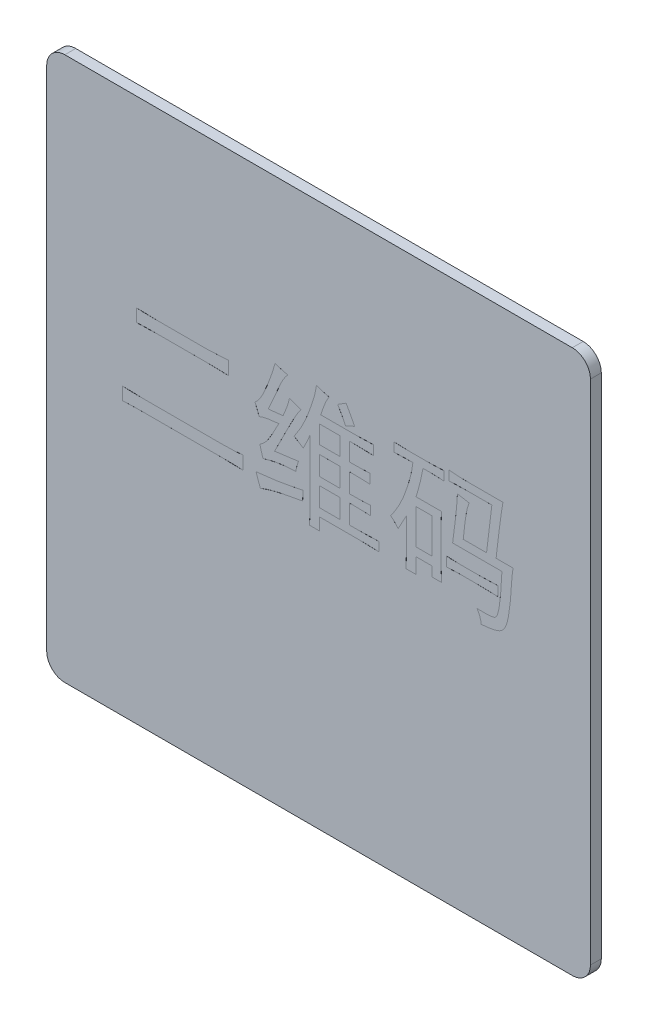
from build123d import *

# Parameters (mm, degrees)
SKETCH_1_W          = 150
SKETCH_1_H          = 150
EXTRUDE_1_DEPTH     = 3
FILLET_1_R          = 5
SKETCH_2_W          = 5.555555555
SKETCH_2_H          = 5.263157895
SKETCH_2_H_2        = 4.970760234
SKETCH_2_W_2        = 4.385964913
SKETCH_2_H_3        = 9.649122807
CUT_EXTRUDE_1_DEPTH = 0.001


with BuildPart() as part:
    # 草图1 → 凸台-拉伸1 (new body)
    with BuildSketch(Plane.XY):
        Rectangle(SKETCH_1_W, SKETCH_1_H)
    extrude(amount=EXTRUDE_1_DEPTH)

    # 圆角1
    fillet_1_edges = [part.edges().sort_by_distance(p)[0] for p in [
        (75, -75, 1.5),
        (-75, -75, 1.5),
        (-75, 75, 1.5),
        (75, 75, 1.5),
    ]]
    fillet(fillet_1_edges, radius=FILLET_1_R)

    # 草图2 → 切除-拉伸1 (cut)
    # profile 1 of 9: a face of its own
    with BuildSketch(Plane.XY.offset(3)):
        with BuildLine():
            add(Edge.make_bspline(
                [(-26.608187135, 3.65497076), (-26.323013282, 3.656655336), (-25.765281416, 3.659949964), (-24.949227561, 3.666790588), (-24.17501589, 3.697113251), (-23.442197097, 3.729213382), (-22.750602914, 3.765136814), (-22.098933489, 3.814417717), (-21.488461424, 3.872008013), (-21.095828364, 3.922845693), (-20.906432749, 3.947368421)],
                knots=[0, 0, 0, 0, 1.198013355, 2.34302766, 3.427946432, 4.4525554, 5.424528626, 6.336949371, 7.197789161, 8, 8, 8, 8], degree=3))
            Line((-20.906432749, 3.947368421), (-20.906432749, 0.292397661))
            add(Edge.make_bspline(
                [(-20.906432749, 0.292397661), (-21.317871677, 0.31594082), (-22.181857979, 0.365379425), (-23.543235953, 0.403957118), (-25.032368749, 0.432096985), (-26.068498144, 0.436370529), (-26.608187135, 0.438596491)],
                knots=[0, 0, 0, 0, 0.866887967, 1.820390043, 2.864705989, 4, 4, 4, 4], degree=3))
            Line((-26.608187135, 0.438596491), (-47.807017544, 0.438596491))
            add(Edge.make_bspline(
                [(-47.807017544, 0.438596491), (-48.413487811, 0.436408949), (-49.570538458, 0.43223546), (-51.223909832, 0.404074428), (-52.7134324, 0.366033277), (-53.651440137, 0.315986879), (-54.093567251, 0.292397661)],
                knots=[0, 0, 0, 0, 1.157187773, 2.207733726, 3.155220703, 4, 4, 4, 4], degree=3))
            Line((-54.093567251, 0.292397661), (-54.093567251, 3.801169591))
            add(Edge.make_bspline(
                [(-54.093567251, 3.801169591), (-53.636995941, 3.777659329), (-52.68630088, 3.728705116), (-51.205860355, 3.690007979), (-49.615662597, 3.661572853), (-48.519977835, 3.657221547), (-47.953216374, 3.65497076)],
                knots=[0, 0, 0, 0, 0.893064927, 1.859583367, 2.892833323, 4, 4, 4, 4], degree=3))
            Line((-47.953216374, 3.65497076), (-26.608187135, 3.65497076))
        make_face()
    # profile 2 of 9: a face of its own
    with BuildSketch(Plane.XY.offset(3)):
        with BuildLine():
            add(Edge.make_bspline(
                [(-30.701754386, 24.269005848), (-30.178348633, 24.29472612), (-29.155032066, 24.345012117), (-27.65654953, 24.411052542), (-26.231042838, 24.490849147), (-25.305049853, 24.538286605), (-24.85380117, 24.561403509)],
                knots=[0, 0, 0, 0, 1.07397973, 2.099750038, 3.073982949, 4, 4, 4, 4], degree=3))
            Line((-24.85380117, 24.561403509), (-24.85380117, 20.906432749))
            add(Edge.make_bspline(
                [(-24.85380117, 20.906432749), (-25.30134963, 20.92983703), (-26.214172279, 20.977572548), (-27.613345457, 21.017317648), (-29.066377156, 21.045655564), (-30.053771588, 21.050280986), (-30.555555556, 21.052631579)],
                knots=[0, 0, 0, 0, 0.942753637, 1.922846234, 2.944411245, 4, 4, 4, 4], degree=3))
            Line((-30.555555556, 21.052631579), (-44.152046784, 21.052631579))
            add(Edge.make_bspline(
                [(-44.152046784, 21.052631579), (-44.718808244, 21.050380792), (-45.814493006, 21.046029486), (-47.404690765, 21.01759436), (-48.885131289, 20.978897223), (-49.83582635, 20.92994301), (-50.292397661, 20.906432749)],
                knots=[0, 0, 0, 0, 1.107166677, 2.140416633, 3.106935073, 4, 4, 4, 4], degree=3))
            Line((-50.292397661, 20.906432749), (-50.292397661, 24.415204678))
            add(Edge.make_bspline(
                [(-50.292397661, 24.415204678), (-49.839436027, 24.391719644), (-48.901368905, 24.343082989), (-47.44801194, 24.304168665), (-45.902936092, 24.275717164), (-44.843348005, 24.271285636), (-44.298245614, 24.269005848)],
                knots=[0, 0, 0, 0, 0.907617697, 1.879643343, 2.909187922, 4, 4, 4, 4], degree=3))
            Line((-44.298245614, 24.269005848), (-30.701754386, 24.269005848))
        make_face()
    # profile 3 of 9: a face of its own
    with BuildSketch(Plane.XY.offset(3)):
        with BuildLine():
            add(Edge.make_bspline(
                [(2.923976608, 29.678362573), (2.80153633, 29.499912457), (2.547382151, 29.129496418), (2.219415274, 28.513585956), (1.896824736, 27.84080946), (1.508161754, 26.877026728), (1.070921309, 25.679980936), (0.742287258, 24.726124382), (0.584795322, 24.269005848)],
                knots=[0, 0, 0, 0, 0.658297212, 1.366453838, 2.12092317, 2.929001811, 4.528279557, 6, 6, 6, 6], degree=3))
            Line((0.584795322, 24.269005848), (9.941520468, 24.269005848))
            add(Edge.make_bspline(
                [(9.941520468, 24.269005848), (10.416232358, 24.271313971), (11.342268482, 24.275816503), (12.694232068, 24.304091529), (13.974343115, 24.34351706), (14.802262682, 24.391757231), (15.204678363, 24.415204678)],
                knots=[0, 0, 0, 0, 1.081761786, 2.110228356, 3.081464224, 4, 4, 4, 4], degree=3))
            Line((15.204678363, 24.415204678), (15.204678363, 21.783625731))
            add(Edge.make_bspline(
                [(15.204678363, 21.783625731), (14.784207065, 21.806990148), (13.932766518, 21.854302322), (12.634666129, 21.894407089), (11.300753347, 21.922760141), (10.398182268, 21.927451126), (9.941520468, 21.929824561)],
                knots=[0, 0, 0, 0, 0.959623765, 1.943206556, 2.95935177, 4, 4, 4, 4], degree=3))
            Line((9.941520468, 21.929824561), (8.479532164, 21.929824561))
            Line((8.479532164, 21.929824561), (8.479532164, 16.959064327))
            add(Edge.make_bspline(
                [(8.479532164, 16.959064327), (9.037271581, 16.961228), (10.096866615, 16.965338552), (11.604044079, 16.993463857), (12.947444883, 17.031185425), (13.787903094, 17.081645092), (14.18128655, 17.105263158)],
                knots=[0, 0, 0, 0, 1.173245013, 2.228934431, 3.171038032, 4, 4, 4, 4], degree=3))
            Line((14.18128655, 17.105263158), (14.18128655, 14.473684211))
            add(Edge.make_bspline(
                [(14.18128655, 14.473684211), (13.787903094, 14.497302277), (12.947444883, 14.547761943), (11.604044079, 14.585483512), (10.096866615, 14.613608817), (9.037271581, 14.617719368), (8.479532164, 14.619883041)],
                knots=[0, 0, 0, 0, 0.828961968, 1.771065569, 2.826754987, 4, 4, 4, 4], degree=3))
            Line((8.479532164, 14.619883041), (8.479532164, 9.356725146))
            add(Edge.make_bspline(
                [(8.479532164, 9.356725146), (8.777351456, 9.355660406), (9.356768492, 9.353588921), (10.201426427, 9.368196215), (11.001059041, 9.376936359), (11.753777315, 9.392422368), (12.462967801, 9.416961812), (13.125734087, 9.433780978), (13.742744807, 9.469613942), (14.137969661, 9.49212812), (14.32748538, 9.502923977)],
                knots=[0, 0, 0, 0, 1.221640602, 2.376741179, 3.465212625, 4.501994121, 5.464954353, 6.376113319, 7.221324142, 8, 8, 8, 8], degree=3))
            Line((14.32748538, 9.502923977), (14.32748538, 7.01754386))
            add(Edge.make_bspline(
                [(14.32748538, 7.01754386), (14.137969661, 7.028339716), (13.742744807, 7.050853894), (13.125734087, 7.086686858), (12.462967801, 7.103506025), (11.753777315, 7.128045468), (11.001059041, 7.143531477), (10.201426427, 7.152271621), (9.356768492, 7.166878915), (8.777351456, 7.16480743), (8.479532164, 7.16374269)],
                knots=[0, 0, 0, 0, 0.778675858, 1.623886681, 2.535045647, 3.498005879, 4.534787375, 5.623258821, 6.778359398, 8, 8, 8, 8], degree=3))
            Line((8.479532164, 7.16374269), (8.479532164, 1.900584795))
            Line((8.479532164, 1.900584795), (10.81871345, 1.900584795))
            add(Edge.make_bspline(
                [(10.81871345, 1.900584795), (11.793518769, 1.907360448), (13.743715819, 1.920915828), (15.692154423, 2.004819283), (16.666666667, 2.046783626)],
                knots=[0, 0, 0, 0, 0.999699306, 2, 2, 2, 2], degree=3))
            Line((16.666666667, 2.046783626), (16.666666667, -0.438596491))
            add(Edge.make_bspline(
                [(16.666666667, -0.438596491), (15.692154423, -0.396632149), (13.743715819, -0.312728694), (11.793518769, -0.299173313), (10.81871345, -0.292397661)],
                knots=[0, 0, 0, 0, 1.000300694, 2, 2, 2, 2], degree=3))
            Line((10.81871345, -0.292397661), (0.292397661, -0.292397661))
            Line((0.292397661, -0.292397661), (0.292397661, -3.65497076))
            Line((0.292397661, -3.65497076), (-2.485380117, -3.65497076))
            add(Edge.make_bspline(
                [(-2.485380117, -3.65497076), (-2.474612779, -3.413110727), (-2.452276123, -2.911376266), (-2.416159307, -2.128267628), (-2.399260917, -1.285084311), (-2.375101923, -0.382728297), (-2.359215512, 0.579339991), (-2.350743215, 1.599166026), (-2.33602101, 2.680277655), (-2.338107522, 3.420325193), (-2.339181287, 3.801169591)],
                knots=[0, 0, 0, 0, 0.779055203, 1.616136557, 2.522486326, 3.492704766, 4.520872923, 5.618651193, 6.774506629, 8, 8, 8, 8], degree=3))
            Line((-2.339181287, 3.801169591), (-2.339181287, 17.98245614))
            add(Edge.make_bspline(
                [(-2.339181287, 17.98245614), (-2.48691284, 17.622384014), (-2.778789265, 16.910981726), (-3.248041443, 15.870743321), (-3.725195706, 14.861647414), (-4.069502783, 14.210759488), (-4.239766082, 13.888888889)],
                knots=[0, 0, 0, 0, 1.034238047, 2.043366479, 3.032425125, 4, 4, 4, 4], degree=3))
            add(Edge.make_bspline(
                [(-4.239766082, 13.888888889), (-4.474049484, 14.050053044), (-4.922801404, 14.358750646), (-5.56899565, 14.791150751), (-6.161388612, 15.169470613), (-6.543936051, 15.391772917), (-6.725146199, 15.497076023)],
                knots=[0, 0, 0, 0, 1.152330951, 2.207201718, 3.150763515, 4, 4, 4, 4], degree=3))
            add(Edge.make_bspline(
                [(-6.725146199, 15.497076023), (-6.301165459, 16.130446669), (-5.461724436, 17.384459537), (-4.631906463, 18.873450631), (-4.118031946, 19.8998508), (-3.850244703, 20.465716201), (-3.584079316, 21.082327406), (-3.299681125, 21.742827324), (-3.01378548, 22.452758433), (-2.722419387, 23.209496182), (-2.423814449, 24.014926907), (-2.120865422, 24.853704119), (-1.825996444, 25.698908749), (-1.56234443, 26.523231279), (-1.321394312, 27.30722167), (-1.116531144, 28.057244581), (-0.935541948, 28.769494832), (-0.791376999, 29.447447748), (-0.667799336, 30.085714003), (-0.611829649, 30.501110628), (-0.584795322, 30.701754386)],
                knots=[0, 0, 0, 0, 2.490442276, 4.930835805, 5.56401899, 6.242237408, 6.976604044, 7.758972555, 8.592638703, 9.477853682, 10.409295137, 11.400190437, 12.392717563, 13.334858334, 14.228778086, 15.073187209, 15.875865532, 16.630288898, 17.338405838, 18, 18, 18, 18], degree=3))
            add(Edge.make_bspline(
                [(-0.584795322, 30.701754386), (-0.311058423, 30.606037478), (0.246179676, 30.411189404), (1.106874956, 30.149534211), (2.000987273, 29.896522444), (2.612939671, 29.751879975), (2.923976608, 29.678362573)],
                knots=[0, 0, 0, 0, 0.951465614, 1.93687037, 2.951373469, 4, 4, 4, 4], degree=3))
        make_face()
        with Locations((3.070175439, 11.988304094)):
            Rectangle(SKETCH_2_W, SKETCH_2_H, mode=Mode.SUBTRACT)
        with Locations((3.070175439, 4.532163742)):
            Rectangle(SKETCH_2_W, SKETCH_2_H, mode=Mode.SUBTRACT)
        with Locations((3.070175439, 19.444444444)):
            Rectangle(SKETCH_2_W, SKETCH_2_H_2, mode=Mode.SUBTRACT)
    # profile 4 of 9: a face of its own
    with BuildSketch(Plane.XY.offset(3)):
        with BuildLine():
            add(Edge.make_bspline(
                [(-8.479532164, 29.239766082), (-8.591868522, 29.122584527), (-8.826221492, 28.878123643), (-9.149447574, 28.453001287), (-9.477439514, 27.973593467), (-9.808048262, 27.435057357), (-10.138969036, 26.839901976), (-10.46058531, 26.180748775), (-10.793104396, 25.467506842), (-11.447465299, 23.904098426), (-12.438559053, 21.530628488), (-13.407133449, 19.45395911), (-13.888888889, 18.421052632)],
                knots=[0, 0, 0, 0, 0.400714873, 0.835960166, 1.317047827, 1.835526487, 2.396351513, 2.998543181, 3.646900272, 4.340084616, 7.184836773, 10, 10, 10, 10], degree=3))
            add(Edge.make_bspline(
                [(-13.888888889, 18.421052632), (-13.207251134, 18.511704658), (-11.846453593, 18.692679162), (-10.478201775, 18.804060076), (-9.795321637, 18.859649123)],
                knots=[0, 0, 0, 0, 1.001820967, 2, 2, 2, 2], degree=3))
            add(Edge.make_bspline(
                [(-9.795321637, 18.859649123), (-9.679243753, 19.12110632), (-9.454209864, 19.627979183), (-9.137053851, 20.367276147), (-8.867878881, 21.069872631), (-8.625988402, 21.728876711), (-8.429791375, 22.350176058), (-8.255319478, 22.925303773), (-8.131378271, 23.463308918), (-8.070239691, 23.810295725), (-8.040935673, 23.976608187)],
                knots=[0, 0, 0, 0, 1.265752913, 2.453846402, 3.558720482, 4.594443122, 5.559199469, 6.441175913, 7.252848044, 8, 8, 8, 8], degree=3))
            Line((-8.040935673, 23.976608187), (-4.824561404, 22.807017544))
            add(Edge.make_bspline(
                [(-4.824561404, 22.807017544), (-4.903590059, 22.712444094), (-5.074825678, 22.507526735), (-5.320585419, 22.149745559), (-5.59506907, 21.733573198), (-5.902534613, 21.258014107), (-6.215539605, 20.708540902), (-6.565435856, 20.103208843), (-6.932540179, 19.431000651), (-7.323927054, 18.687090029), (-7.757443895, 17.861531456), (-8.232165589, 16.933746916), (-8.762450169, 15.904794412), (-9.336826703, 14.767862066), (-9.964944016, 13.52788587), (-10.647866253, 12.183558163), (-11.371024396, 10.729369246), (-11.874209594, 9.72834662), (-12.134502924, 9.210526316)],
                knots=[0, 0, 0, 0, 0.382609317, 0.829020099, 1.346782268, 1.931532289, 2.587270652, 3.310427429, 4.103240491, 4.96591437, 5.921278782, 6.999402525, 8.202873429, 9.516612758, 10.955704963, 12.520150345, 14.199904019, 16, 16, 16, 16], degree=3))
            Line((-12.134502924, 9.210526316), (-5.555555556, 10.087719298))
            add(Edge.make_bspline(
                [(-5.555555556, 10.087719298), (-5.64543568, 9.810217527), (-5.814002537, 9.289773192), (-6.029745977, 8.550962435), (-6.182850989, 7.90149866), (-6.253904057, 7.496171089), (-6.286549708, 7.30994152)],
                knots=[0, 0, 0, 0, 1.21726773, 2.282940721, 3.211089424, 4, 4, 4, 4], degree=3))
            add(Edge.make_bspline(
                [(-6.286549708, 7.30994152), (-6.613362777, 7.305896499), (-7.291161557, 7.297507268), (-8.338518548, 7.221064663), (-9.451260562, 7.108748616), (-10.614023762, 6.945772051), (-11.804746504, 6.743550373), (-12.997453791, 6.495096095), (-14.180195892, 6.196909847), (-14.959999018, 5.964466166), (-15.350877193, 5.847953216)],
                knots=[0, 0, 0, 0, 0.851274813, 1.765513942, 2.734473969, 3.764518578, 4.823550506, 5.88036719, 6.937529005, 8, 8, 8, 8], degree=3))
            add(Edge.make_bspline(
                [(-15.350877193, 5.847953216), (-15.445229652, 6.130621905), (-15.627123908, 6.675555356), (-15.85268507, 7.473626978), (-16.068271564, 8.209804994), (-16.176222885, 8.688310247), (-16.228070175, 8.918128655)],
                knots=[0, 0, 0, 0, 1.119271266, 2.157749964, 3.115196822, 4, 4, 4, 4], degree=3))
            add(Edge.make_bspline(
                [(-16.228070175, 8.918128655), (-16.116384005, 8.971260508), (-15.884731061, 9.081463501), (-15.558273183, 9.308095515), (-15.230006121, 9.577249637), (-14.899682661, 9.891420481), (-14.572124479, 10.256094066), (-14.237441523, 10.662195289), (-13.917747393, 11.12614713), (-13.470439281, 11.806749171), (-12.922162482, 12.726620518), (-12.26953825, 13.887262917), (-11.604438947, 15.10346764), (-11.180834308, 15.945211045), (-10.964912281, 16.374269006)],
                knots=[0, 0, 0, 0, 0.480181851, 0.995965211, 1.539593252, 2.130283722, 2.766143882, 3.444570572, 4.174706954, 4.955210511, 6.611250604, 8.336458694, 10.132600088, 12, 12, 12, 12], degree=3))
            add(Edge.make_bspline(
                [(-10.964912281, 16.374269006), (-11.483332025, 16.32385768), (-12.486264965, 16.226332113), (-13.710173438, 16.055345053), (-14.622999891, 15.889439879), (-15.249894273, 15.745257096), (-15.830941859, 15.567957745), (-16.196474534, 15.421913073), (-16.374269006, 15.350877193)],
                knots=[0, 0, 0, 0, 1.696581853, 3.282201044, 4.023681963, 4.718198358, 5.376533859, 6, 6, 6, 6], degree=3))
            add(Edge.make_bspline(
                [(-16.374269006, 15.350877193), (-16.453510282, 15.55850891), (-16.621188667, 15.997867696), (-16.891323991, 16.694484972), (-17.207170063, 17.459436328), (-17.4283452, 17.995093144), (-17.543859649, 18.274853801)],
                knots=[0, 0, 0, 0, 0.846791778, 1.79185248, 2.846737717, 4, 4, 4, 4], degree=3))
            add(Edge.make_bspline(
                [(-17.543859649, 18.274853801), (-17.431573408, 18.35891512), (-17.190401814, 18.539464419), (-16.850853408, 18.887490862), (-16.506447679, 19.317587608), (-16.156900005, 19.828121032), (-15.798405396, 20.417917134), (-15.430615982, 21.089509416), (-15.060691236, 21.846472267), (-14.552032129, 22.971191887), (-13.931455686, 24.463487985), (-13.234171781, 26.330246892), (-12.575787598, 28.266582115), (-12.185769521, 29.592067239), (-11.988304094, 30.263157895)],
                knots=[0, 0, 0, 0, 0.377511018, 0.810828941, 1.305308524, 1.861135115, 2.476712082, 3.16451831, 3.923617733, 4.746344391, 6.490479131, 8.277299898, 10.115203854, 12, 12, 12, 12], degree=3))
            add(Edge.make_bspline(
                [(-11.988304094, 30.263157895), (-11.714567195, 30.167440987), (-11.157329096, 29.972592913), (-10.296633816, 29.71093772), (-9.402521499, 29.457925953), (-8.790569101, 29.313283484), (-8.479532164, 29.239766082)],
                knots=[0, 0, 0, 0, 0.951465614, 1.93687037, 2.951373469, 4, 4, 4, 4], degree=3))
        make_face()
    # profile 5 of 9: a face of its own
    with BuildSketch(Plane.XY.offset(3)):
        with BuildLine():
            add(Edge.make_bspline(
                [(-4.239766082, 3.801169591), (-4.262861963, 3.563035818), (-4.307609796, 3.101656152), (-4.349426718, 2.424373225), (-4.378021587, 1.785309709), (-4.383379904, 1.369964986), (-4.385964912, 1.169590643)],
                knots=[0, 0, 0, 0, 1.088827181, 2.109582004, 3.088007521, 4, 4, 4, 4], degree=3))
            add(Edge.make_bspline(
                [(-4.385964912, 1.169590643), (-4.83733997, 1.09281565), (-5.764419968, 0.935127361), (-7.190852893, 0.675700148), (-8.687432544, 0.378919107), (-10.237839761, 0.076610003), (-11.78772118, -0.267224465), (-13.288029407, -0.660736411), (-14.715812317, -1.10265425), (-15.632037557, -1.441718653), (-16.081871345, -1.608187135)],
                knots=[0, 0, 0, 0, 0.912559914, 1.874308358, 2.889550752, 3.953461397, 5.022595812, 6.053102821, 7.044143194, 8, 8, 8, 8], degree=3))
            add(Edge.make_bspline(
                [(-16.081871345, -1.608187135), (-16.278556455, -1.060100384), (-16.679412205, 0.056932446), (-17.058419549, 1.181567693), (-17.251461988, 1.754385965)],
                knots=[0, 0, 0, 0, 0.981326127, 2, 2, 2, 2], degree=3))
            add(Edge.make_bspline(
                [(-17.251461988, 1.754385965), (-16.771282743, 1.804264922), (-15.826791919, 1.90237457), (-14.433020211, 2.05857275), (-13.08643937, 2.226343495), (-11.978273745, 2.377276337), (-11.068768659, 2.514479451), (-10.31677739, 2.641427067), (-9.487688887, 2.780421886), (-8.583552292, 2.943846105), (-7.603507558, 3.128206017), (-6.549247071, 3.333178226), (-5.42030033, 3.563488945), (-4.642299777, 3.720126225), (-4.239766082, 3.801169591)],
                knots=[0, 0, 0, 0, 1.318666836, 2.593757936, 3.830843884, 5.025214117, 5.648562045, 6.34317179, 7.108299519, 7.944814852, 8.852780321, 9.832244771, 10.878414007, 12, 12, 12, 12], degree=3))
        make_face()
    # profile 6 of 9: a face of its own
    with BuildSketch(Plane.XY.offset(3)):
        with BuildLine():
            add(Edge.make_bspline(
                [(7.602339181, 30.555555556), (7.656577349, 30.468984532), (7.781313674, 30.269889471), (7.989808398, 29.931479178), (8.214547638, 29.499662682), (8.49804844, 28.99842923), (8.800004998, 28.404513024), (9.15839314, 27.737393808), (9.529748967, 26.976238786), (9.799858734, 26.447101772), (9.941520468, 26.169590643)],
                knots=[0, 0, 0, 0, 0.493093895, 1.134011773, 1.917545387, 2.841519138, 3.91304544, 5.13265968, 6.49619507, 8, 8, 8, 8], degree=3))
            add(Edge.make_bspline(
                [(9.941520468, 26.169590643), (9.742443595, 26.091499789), (9.335729873, 25.931960304), (8.721381965, 25.661439316), (8.094360839, 25.343983919), (7.672221325, 25.116461915), (7.456140351, 25)],
                knots=[0, 0, 0, 0, 0.933353088, 1.906838812, 2.928571492, 4, 4, 4, 4], degree=3))
            add(Edge.make_bspline(
                [(7.456140351, 25), (7.322291221, 25.306609785), (7.040809511, 25.95140327), (6.527826575, 26.934305794), (5.941859513, 27.999050017), (5.495826508, 28.718351103), (5.263157895, 29.093567251)],
                knots=[0, 0, 0, 0, 0.863360023, 1.815626714, 2.860543731, 4, 4, 4, 4], degree=3))
            Line((5.263157895, 29.093567251), (7.602339181, 30.555555556))
        make_face()
    # profile 7 of 9: a face of its own
    with BuildSketch(Plane.XY.offset(3)):
        with BuildLine():
            add(Edge.make_bspline(
                [(30.263157895, 27.777777778), (30.609720846, 27.780295631), (31.317380078, 27.785436926), (32.394994139, 27.814074985), (33.510744404, 27.855323804), (34.264749638, 27.900796007), (34.649122807, 27.923976608)],
                knots=[0, 0, 0, 0, 0.947536656, 1.93480884, 2.947216761, 4, 4, 4, 4], degree=3))
            Line((34.649122807, 27.923976608), (34.649122807, 25.438596491))
            add(Edge.make_bspline(
                [(34.649122807, 25.438596491), (34.262928804, 25.461444974), (33.544887757, 25.503926598), (32.548362628, 25.545729351), (31.716287707, 25.575500097), (31.216175024, 25.581937474), (30.994152047, 25.584795322)],
                knots=[0, 0, 0, 0, 1.268998401, 2.359417629, 3.271670174, 4, 4, 4, 4], degree=3))
            Line((30.994152047, 25.584795322), (28.801169591, 25.584795322))
            add(Edge.make_bspline(
                [(28.801169591, 25.584795322), (28.694502031, 24.984500609), (28.474443912, 23.746076041), (28.031688643, 21.856005709), (27.515536544, 19.869974588), (27.109215706, 18.526224105), (26.900584795, 17.83625731)],
                knots=[0, 0, 0, 0, 0.916233885, 1.890215804, 2.916702871, 4, 4, 4, 4], degree=3))
            Line((26.900584795, 17.83625731), (33.918128655, 17.83625731))
            add(Edge.make_bspline(
                [(33.918128655, 17.83625731), (33.895018949, 17.433828411), (33.850265824, 16.654504296), (33.808943168, 15.52074183), (33.779859028, 14.461196782), (33.774506577, 13.77880586), (33.771929825, 13.450292398)],
                knots=[0, 0, 0, 0, 1.102078905, 2.134232082, 3.101790691, 4, 4, 4, 4], degree=3))
            Line((33.771929825, 13.450292398), (33.771929825, 6.432748538))
            add(Edge.make_bspline(
                [(33.771929825, 6.432748538), (33.771068757, 6.264881978), (33.769253855, 5.911063645), (33.784485198, 5.353428086), (33.79268624, 4.741483541), (33.809424438, 4.075452422), (33.833414436, 3.353608064), (33.850703386, 2.577228413), (33.887816336, 1.745440023), (33.907793805, 1.173217942), (33.918128655, 0.877192982)],
                knots=[0, 0, 0, 0, 0.72485181, 1.527796002, 2.40866786, 3.367627942, 4.404712684, 5.527496796, 6.720911536, 8, 8, 8, 8], degree=3))
            Line((33.918128655, 0.877192982), (31.286549708, 0.877192982))
            Line((31.286549708, 0.877192982), (31.286549708, 3.50877193))
            Line((31.286549708, 3.50877193), (26.900584795, 3.50877193))
            Line((26.900584795, 3.50877193), (26.900584795, -0.730994152))
            Line((26.900584795, -0.730994152), (24.122807018, -0.730994152))
            add(Edge.make_bspline(
                [(24.122807018, -0.730994152), (24.133196427, -0.43316653), (24.153409322, 0.146265643), (24.190161334, 0.990706594), (24.207920718, 1.790531074), (24.231515275, 2.54307506), (24.248447275, 3.25242095), (24.256551582, 3.91490019), (24.271743059, 4.532107229), (24.269892859, 4.927434009), (24.269005848, 5.116959064)],
                knots=[0, 0, 0, 0, 1.222572305, 2.378549447, 3.467433708, 4.504505659, 5.467364503, 6.378255015, 7.222513313, 8, 8, 8, 8], degree=3))
            Line((24.269005848, 5.116959064), (24.269005848, 11.988304094))
            add(Edge.make_bspline(
                [(24.269005848, 11.988304094), (24.092355532, 11.661487651), (23.729808678, 10.990748556), (23.16524897, 9.95710077), (22.55843477, 8.872725849), (22.142783919, 8.129388205), (21.929824561, 7.748538012)],
                knots=[0, 0, 0, 0, 0.920640067, 1.88946823, 2.918665778, 4, 4, 4, 4], degree=3))
            add(Edge.make_bspline(
                [(21.929824561, 7.748538012), (21.781143486, 7.940520242), (21.484589391, 8.323441314), (20.987710968, 8.853208044), (20.457944238, 9.350086467), (20.075023166, 9.646640562), (19.883040936, 9.795321637)],
                knots=[0, 0, 0, 0, 1.002724816, 2, 2.997275184, 4, 4, 4, 4], degree=3))
            add(Edge.make_bspline(
                [(19.883040936, 9.795321637), (20.101153311, 10.09083295), (20.539324617, 10.684492884), (21.138589662, 11.620552778), (21.725499364, 12.579628086), (22.266602339, 13.580274691), (22.784921978, 14.611568516), (23.26488722, 15.6783273), (23.714968273, 16.778054596), (24.126203329, 17.899224182), (24.499908683, 19.01502163), (24.838962859, 20.095154059), (25.148477002, 21.125109813), (25.399538974, 22.111139656), (25.617692872, 23.047846048), (25.797826803, 23.935675136), (25.936693909, 24.775310593), (25.995134404, 25.320960332), (26.023391813, 25.584795322)],
                knots=[0, 0, 0, 0, 1.029735011, 2.068659954, 3.115569091, 4.182453475, 5.257698297, 6.351898127, 7.461998532, 8.589412383, 9.700274166, 10.761656968, 11.764287938, 12.715744595, 13.614525528, 14.461287621, 15.255994943, 16, 16, 16, 16], degree=3))
            add(Edge.make_bspline(
                [(26.023391813, 25.584795322), (25.146036161, 25.578017986), (23.390673337, 25.564458281), (21.63726399, 25.480560801), (20.760233918, 25.438596491)],
                knots=[0, 0, 0, 0, 0.999628839, 2, 2, 2, 2], degree=3))
            Line((20.760233918, 25.438596491), (20.760233918, 27.923976608))
            add(Edge.make_bspline(
                [(20.760233918, 27.923976608), (21.184327366, 27.900915428), (21.999786628, 27.856572717), (23.178640974, 27.814987609), (24.265254256, 27.785838079), (24.960275201, 27.780384042), (25.292397661, 27.777777778)],
                knots=[0, 0, 0, 0, 1.123814671, 2.160903657, 3.12117008, 4, 4, 4, 4], degree=3))
            Line((25.292397661, 27.777777778), (30.263157895, 27.777777778))
        make_face()
        with Locations((29.093567252, 10.67251462)):
            Rectangle(SKETCH_2_W_2, SKETCH_2_H_3, mode=Mode.SUBTRACT)
    # profile 8 of 9: a face of its own
    with BuildSketch(Plane.XY.offset(3)):
        with BuildLine():
            Line((46.34502924, 14.18128655), (47.807017544, 26.315789474))
            Line((47.807017544, 26.315789474), (41.081871345, 26.315789474))
            add(Edge.make_bspline(
                [(41.081871345, 26.315789474), (40.24061974, 26.308690066), (38.533992333, 26.294287663), (36.829304558, 26.211546183), (35.964912281, 26.169590643)],
                knots=[0, 0, 0, 0, 0.985864402, 2, 2, 2, 2], degree=3))
            Line((35.964912281, 26.169590643), (35.964912281, 28.801169591))
            add(Edge.make_bspline(
                [(35.964912281, 28.801169591), (36.399612571, 28.75444771), (37.262453192, 28.661709019), (38.552588093, 28.583504512), (39.823117459, 28.514927285), (40.664836747, 28.510811245), (41.081871345, 28.50877193)],
                knots=[0, 0, 0, 0, 1.022980025, 2.030522499, 3.024211195, 4, 4, 4, 4], degree=3))
            Line((41.081871345, 28.50877193), (50.877192982, 28.50877193))
            add(Edge.make_bspline(
                [(50.877192982, 28.50877193), (50.84644102, 28.335513066), (50.782086251, 27.972933459), (50.682731559, 27.404966725), (50.589466474, 26.78461704), (50.475213713, 26.116737993), (50.379247928, 25.394712363), (50.260990708, 24.627012294), (50.147447295, 23.807496682), (50.038240737, 22.936453063), (49.907139769, 22.017497009), (49.79468166, 21.044900892), (49.659845436, 20.024377408), (49.533315009, 18.951602894), (49.395321368, 17.831274247), (49.261812061, 16.659442138), (49.120815346, 15.437535532), (49.025298552, 14.605448723), (48.976608187, 14.18128655)],
                knots=[0, 0, 0, 0, 0.584319367, 1.222807778, 1.914521407, 2.667309376, 3.472526169, 4.332847181, 5.246562632, 6.21967591, 7.247838915, 8.328732335, 9.470583729, 10.665965448, 11.915617254, 13.218836686, 14.582282208, 16, 16, 16, 16], degree=3))
            Line((48.976608187, 14.18128655), (53.65497076, 14.18128655))
            add(Edge.make_bspline(
                [(53.65497076, 14.18128655), (53.630883248, 14.035183039), (53.579223661, 13.721840296), (53.510033046, 13.21618816), (53.439154423, 12.644223133), (53.374169879, 12.003323526), (53.318500916, 11.293320208), (53.249849683, 10.514170242), (53.191462994, 9.665676952), (53.123982493, 8.455539374), (53.02286473, 6.930324357), (52.842465701, 5.139364306), (52.622359837, 3.419768241), (52.398793731, 2.042924972), (52.194395945, 1.004086449), (52.011047652, 0.303881657), (51.801477264, -0.324035538), (51.568571022, -0.882866838), (51.31063906, -1.372617435), (51.025233672, -1.792309624), (50.712181903, -2.140645201), (50.365760481, -2.429203559), (49.95780954, -2.659443546), (49.482161709, -2.865317641), (48.920452887, -3.04487621), (48.277824526, -3.213831461), (47.547671544, -3.349816447), (46.73494567, -3.473241607), (45.837932751, -3.583923915), (45.209991091, -3.630644678), (44.883040936, -3.65497076)],
                knots=[0, 0, 0, 0, 0.543273685, 1.165138785, 1.872365702, 2.657831568, 3.528410468, 4.485332126, 5.527587493, 6.648719643, 8.932340383, 11.135200124, 13.251966039, 15.292204126, 16.251985859, 17.13544107, 17.945886079, 18.678933978, 19.354412134, 19.973449917, 20.536075629, 21.067721687, 21.619724183, 22.248427602, 22.966729647, 23.781088372, 24.685031015, 25.689990786, 26.797248342, 28, 28, 28, 28], degree=3))
            add(Edge.make_bspline(
                [(44.883040936, -3.65497076), (44.846541359, -3.384694984), (44.772768399, -2.838413477), (44.531579564, -2.026224826), (44.178668121, -1.218873347), (43.870871167, -0.702627355), (43.713450292, -0.438596491)],
                knots=[0, 0, 0, 0, 0.946539849, 1.913146716, 2.932691617, 4, 4, 4, 4], degree=3))
            add(Edge.make_bspline(
                [(43.713450292, -0.438596491), (44.014844836, -0.448507832), (44.590463423, -0.467437015), (45.410073824, -0.480566996), (46.144948516, -0.469285815), (46.791383466, -0.443290416), (47.352021139, -0.403962032), (47.825632918, -0.338632144), (48.214622496, -0.262358232), (48.53790282, -0.161403166), (48.813783826, 0.015158715), (49.038628326, 0.304150516), (49.248545825, 0.688101088), (49.431644739, 1.180570784), (49.603642083, 1.774313275), (49.759090374, 2.47417418), (49.891230822, 3.282688123), (50.124428753, 5.141279297), (50.395974856, 8.004668098), (50.522153868, 10.569030116), (50.584795322, 11.842105263)],
                knots=[0, 0, 0, 0, 0.944611031, 1.804066055, 2.567415507, 3.246462588, 3.830559931, 4.327099246, 4.742914547, 5.071906634, 5.382403803, 5.751594351, 6.204641405, 6.750608408, 7.392883352, 8.140428684, 8.994623402, 9.958180969, 14.007646393, 18, 18, 18, 18], degree=3))
            Line((50.584795322, 11.842105263), (36.988304094, 11.842105263))
            add(Edge.make_bspline(
                [(36.988304094, 11.842105263), (37.131722321, 12.908489885), (37.416408526, 15.025270964), (37.792934578, 18.174458976), (38.124764088, 21.248080565), (38.245126313, 23.275662927), (38.304093567, 24.269005848)],
                knots=[0, 0, 0, 0, 1.032924633, 2.050362764, 3.044843562, 4, 4, 4, 4], degree=3))
            Line((38.304093567, 24.269005848), (41.520467836, 23.684210526))
            add(Edge.make_bspline(
                [(41.520467836, 23.684210526), (41.424830451, 23.41824056), (41.219668948, 22.847681276), (40.97029722, 21.907944185), (40.752497872, 20.831162933), (40.557467666, 19.634707679), (40.384869453, 18.346219533), (40.216291003, 16.999753389), (40.060315766, 15.605950022), (39.962175317, 14.661463571), (39.912280702, 14.18128655)],
                knots=[0, 0, 0, 0, 0.701847259, 1.505604092, 2.41216556, 3.430073558, 4.516233069, 5.641238224, 6.800805238, 8, 8, 8, 8], degree=3))
            Line((39.912280702, 14.18128655), (46.34502924, 14.18128655))
        make_face()
    # profile 9 of 9: a face of its own
    with BuildSketch(Plane.XY.offset(3)):
        with BuildLine():
            add(Edge.make_bspline(
                [(44.005847953, 7.748538012), (44.162884958, 7.747711184), (44.498655704, 7.745943291), (45.032823415, 7.761176852), (45.632132898, 7.769462158), (46.294554242, 7.786112605), (47.021815621, 7.810071935), (47.81082055, 7.827479744), (48.664272634, 7.86461904), (49.254548216, 7.884435327), (49.561403509, 7.894736842)],
                knots=[0, 0, 0, 0, 0.678091674, 1.449870675, 2.307369663, 3.266336105, 4.311218384, 5.449592328, 6.674168275, 8, 8, 8, 8], degree=3))
            Line((49.561403509, 7.894736842), (49.561403509, 5.263157895))
            add(Edge.make_bspline(
                [(49.561403509, 5.263157895), (48.931527272, 5.286197555), (47.726078008, 5.330290567), (45.998606801, 5.371723676), (44.435516939, 5.40108199), (43.448137618, 5.406704812), (42.98245614, 5.409356725)],
                knots=[0, 0, 0, 0, 1.149311971, 2.199538877, 3.150841648, 4, 4, 4, 4], degree=3))
            Line((42.98245614, 5.409356725), (39.18128655, 5.409356725))
            add(Edge.make_bspline(
                [(39.18128655, 5.409356725), (38.897894915, 5.406721328), (38.300321773, 5.401164204), (37.359905048, 5.371950791), (36.32723132, 5.330227196), (35.609272006, 5.28618398), (35.233918129, 5.263157895)],
                knots=[0, 0, 0, 0, 0.860816896, 1.81515964, 2.857751009, 4, 4, 4, 4], degree=3))
            Line((35.233918129, 5.263157895), (35.233918129, 7.894736842))
            add(Edge.make_bspline(
                [(35.233918129, 7.894736842), (35.517168938, 7.871176393), (36.113758715, 7.821552798), (37.054816523, 7.783296105), (38.087327007, 7.754940397), (38.805837396, 7.750735323), (39.18128655, 7.748538012)],
                knots=[0, 0, 0, 0, 0.863117629, 1.817919442, 2.859779467, 4, 4, 4, 4], degree=3))
            Line((39.18128655, 7.748538012), (44.005847953, 7.748538012))
        make_face()
    extrude(amount=-CUT_EXTRUDE_1_DEPTH, mode=Mode.SUBTRACT)


solid = part.part
